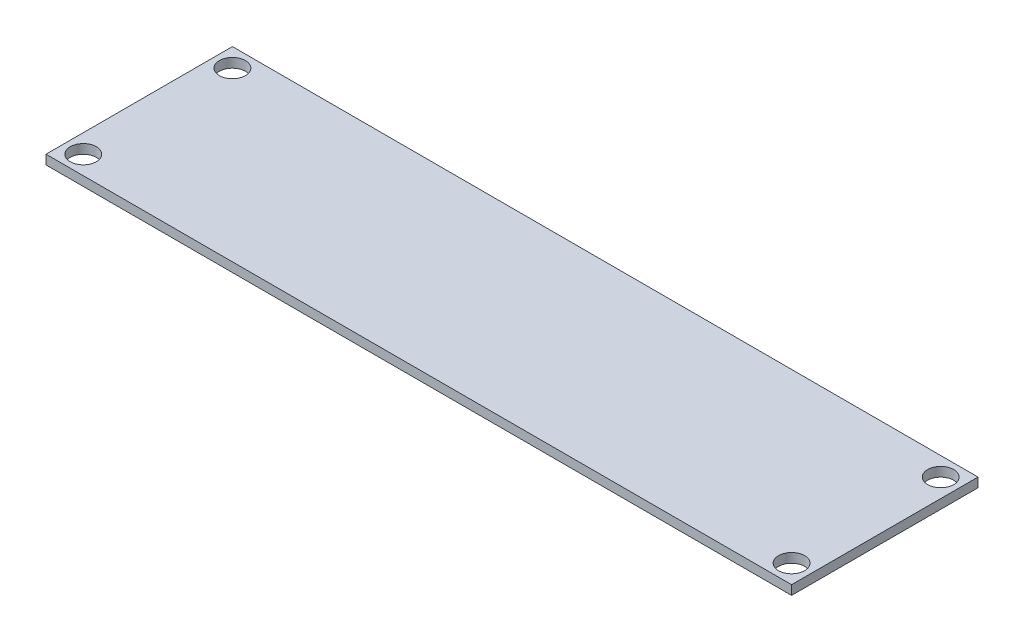
from build123d import *

# Parameters (mm, degrees)
SKETCH1_W           = 80
SKETCH1_H           = 20
BOSS_EXTRUDE1_DEPTH = 1
SKETCH2_R           = 1.4
CUT_EXTRUDE1_DEPTH  = 83.46817568


with BuildPart() as part:
    # Sketch1 → Boss-Extrude1 (new body)
    with BuildSketch(Plane(origin=(0, 0, 0), x_dir=(1, 0, 0), z_dir=(0, 1, 0))):
        with Locations((40, 10)):
            Rectangle(SKETCH1_W, SKETCH1_H)
    extrude(amount=BOSS_EXTRUDE1_DEPTH)

    # Sketch2 → Cut-Extrude1 (cut, through all)
    with BuildSketch(Plane(origin=(0, 1, 0), x_dir=(1, 0, 0), z_dir=(0, 1, 0))):
        with Locations(Location((2, 18, 0), (0, 0, 270))):
            Circle(SKETCH2_R)
        with Locations(Location((78, 18, 0), (0, 0, 270))):
            Circle(SKETCH2_R)
        with Locations(Location((78, 2, 0), (0, 0, 270))):
            Circle(SKETCH2_R)
        with Locations(Location((2, 2, 0), (0, 0, 270))):
            Circle(SKETCH2_R)
    extrude(amount=-CUT_EXTRUDE1_DEPTH, mode=Mode.SUBTRACT)


solid = part.part
